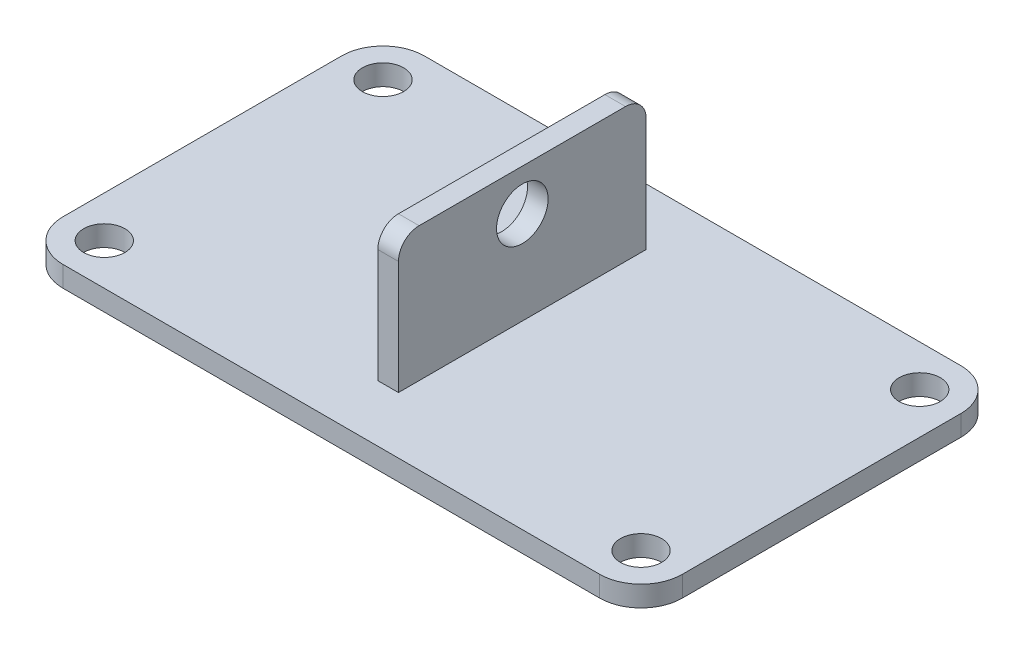
from build123d import *

# Parameters (mm, degrees)
SKETCH1_W           = 300
SKETCH1_H           = 175
BOSS_EXTRUDE1_DEPTH = 10
SKETCH2_W           = 120
SKETCH2_H           = 65
SKETCH2_R           = 12.5
BOSS_EXTRUDE2_DEPTH = 5
FILLET1_R           = 20
FILLET2_R           = 10
HOLE1_D             = 20


with BuildPart() as part:
    # Sketch1 → Boss-Extrude1 (new body)
    with BuildSketch(Plane(origin=(0, 0, 0), x_dir=(1, 0, 0), z_dir=(0, 1, 0))):
        Rectangle(SKETCH1_W, SKETCH1_H)
    extrude(amount=BOSS_EXTRUDE1_DEPTH)

    # Sketch2 → Boss-Extrude2 (add, symmetric)
    with BuildSketch(Plane(origin=(0, 0, 0), x_dir=(0, 0, -1), z_dir=(1, 0, 0))):
        with Locations((0, 42.5)):
            Rectangle(SKETCH2_W, SKETCH2_H)
        with Locations((0, 55)):
            Circle(SKETCH2_R, mode=Mode.SUBTRACT)
    extrude(amount=BOSS_EXTRUDE2_DEPTH, both=True)

    # Fillet1
    fillet1_edges = [part.edges().sort_by_distance(p)[0] for p in [
        (-150, 5, -87.5),
        (150, 5, -87.5),
        (150, 5, 87.5),
        (-150, 5, 87.5),
    ]]
    fillet(fillet1_edges, radius=FILLET1_R)

    # Fillet2
    fillet2_edges = [part.edges().sort_by_distance(p)[0] for p in [
        (0, 75, 60),
        (0, 75, -60),
    ]]
    fillet(fillet2_edges, radius=FILLET2_R)

    # Hole1 (through all)
    with Locations(Plane(origin=(0, 10, 0), x_dir=(1, 0, 0), z_dir=(0, 1, 0))):
        with Locations((-130, -67.5), (-130, 67.5)):
            hole1 = Hole(HOLE1_D / 2)

    # Mirror1: Hole1 across plane
    add(hole1.mirror(Plane(origin=(0, 0, 0), x_dir=(0, 0, 1), z_dir=(1, 0, 0))), mode=Mode.SUBTRACT)


solid = part.part
